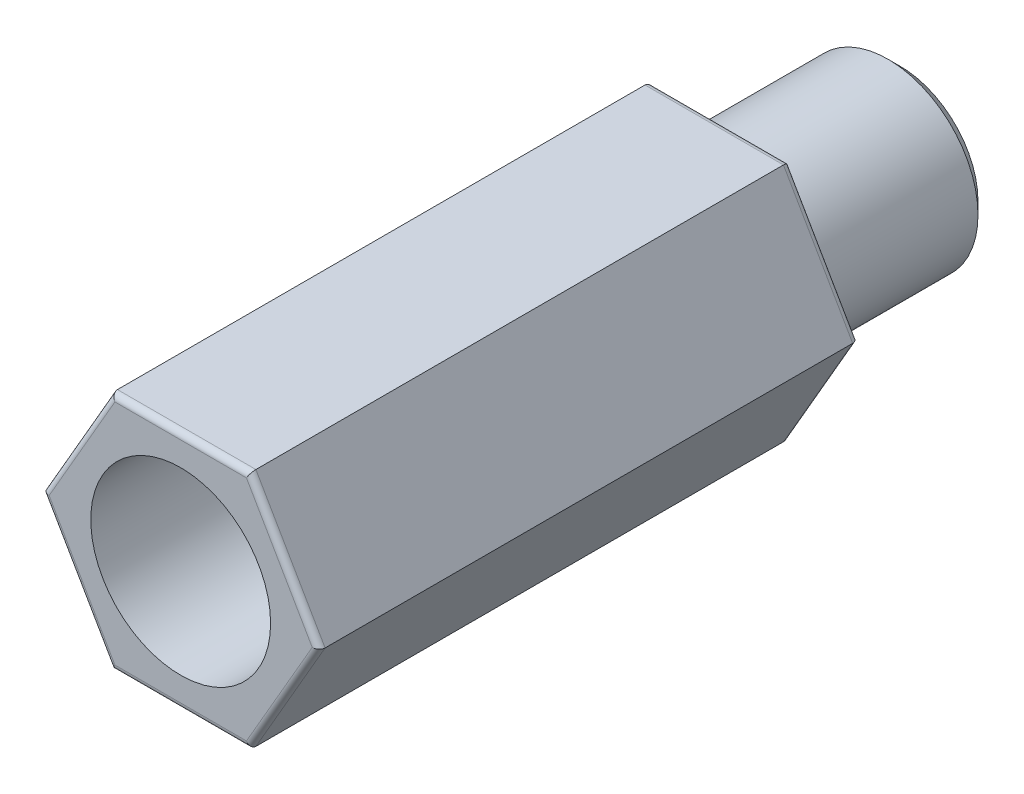
from build123d import *

# Parameters (mm, degrees)
SKICA1_R                = 1.5
P_IDAT_VYSUNUT_M1_DEPTH = 3
SKICA2_R                = 1.5
P_IDAT_VYSUNUT_M2_DEPTH = 9
ZKOSEN_1_SIZE           = 0.2
ZAOBLIT1_R              = 0.1


with BuildPart() as part:
    # Skica1 → Přidat vysunutím1 (new body)
    with BuildSketch(Plane.XY):
        Circle(SKICA1_R)
    extrude(amount=P_IDAT_VYSUNUT_M1_DEPTH)

    # Zkosení1
    zkosen_1_edges = [part.edges().sort_by_distance(p)[0] for p in [
        (-1.5, 0, 0),
    ]]
    chamfer(zkosen_1_edges, length=ZKOSEN_1_SIZE)


with BuildPart() as body_2:
    # Skica2 → Přidat vysunutím2 (new body)
    with BuildSketch(Plane.XY.offset(3)):
        Polygon((2.309401077, 0), (1.154700538, 2), (-1.154700538, 2), (-2.309401077, 0), (-1.154700538, -2), (1.154700538, -2), align=None)
        Circle(SKICA2_R, mode=Mode.SUBTRACT)
    extrude(amount=P_IDAT_VYSUNUT_M2_DEPTH)

    # Zaoblit1
    zaoblit1_edges = [body_2.edges().sort_by_distance(p)[0] for p in [
        (0, 2, 12),
        (-1.732050808, 1, 12),
        (-1.5, 0, 3),
        (-1.732050808, -1, 12),
        (0, -2, 12),
        (1.732050808, -1, 12),
        (0, -2, 3),
        (-1.732050808, -1, 3),
        (-1.732050808, 1, 3),
        (0, 2, 3),
        (1.732050808, 1, 3),
        (1.732050808, -1, 3),
        (1.732050808, 1, 12),
    ]]
    fillet(zaoblit1_edges, radius=ZAOBLIT1_R)


solid = Compound([part.part, body_2.part])
